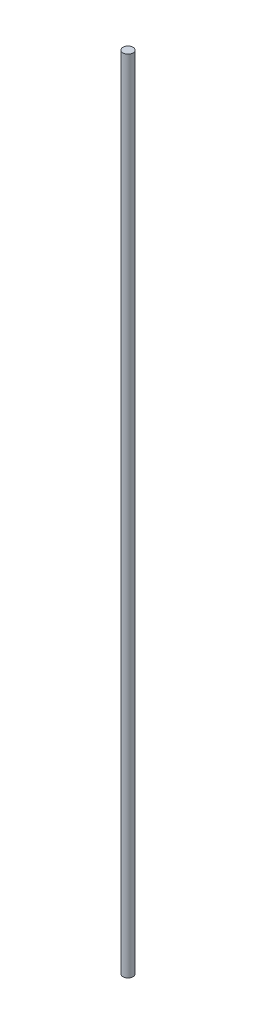
from build123d import *

# Parameters (mm, degrees)
SKETCH_1_R      = 1
EXTRUDE_1_DEPTH = 160


with BuildPart() as part:
    # 草图1 → 凸台-拉伸1 (new body)
    with BuildSketch(Plane(origin=(0, 0, 0), x_dir=(1, 0, 0), z_dir=(0, 1, 0))):
        with Locations(Location((0, 0, 0), (0, 0, 270))):
            Circle(SKETCH_1_R)
    extrude(amount=EXTRUDE_1_DEPTH)


solid = part.part
